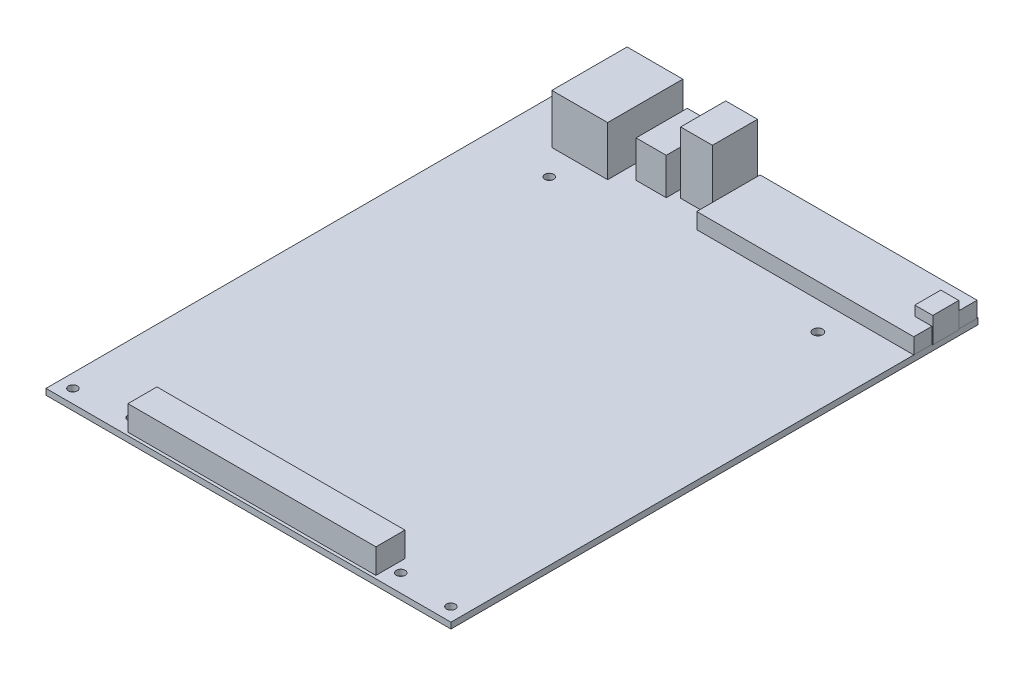
from build123d import *

# Parameters (mm, degrees)
SKETCH1_W           = 114.55401
SKETCH1_H           = 149.09799
SKETCH1_R           = 1.249995
SKETCH1_R_2         = 1.37919162
BOSS_EXTRUDE1_DEPTH = 1.69
SKETCH2_W           = 15.779027005
SKETCH2_H           = 21.279879663
BOSS_EXTRUDE2_DEPTH = 14
SKETCH2_3_W         = 70.152219837
SKETCH2_3_H         = 8.208296776
BOSS_EXTRUDE3_DEPTH = 7
SKETCH2_4_W         = 8.526889658
SKETCH2_4_H         = 14.502739447
BOSS_EXTRUDE4_DEPTH = 10.4
BOSS_EXTRUDE5_DEPTH = 4.46
SKETCH2_6_W         = 5.077021517
SKETCH2_6_H         = 7.355
BOSS_EXTRUDE6_DEPTH = 7.22
SKETCH3_W           = 8.992
SKETCH3_H           = 17.501
BOSS_EXTRUDE7_DEPTH = 12.76


with BuildPart() as part:
    # Sketch1 → Boss-Extrude1 (new body)
    with BuildSketch(Plane(origin=(0, 0, 0), x_dir=(1, 0, 0), z_dir=(0, 1, 0))):
        with Locations((57.376465546, 74.495783937)):
            Rectangle(SKETCH1_W, SKETCH1_H)
        with Locations((3.909460546, 145.234788937)):
            Circle(SKETCH1_R, mode=Mode.SUBTRACT)
        with Locations((19.453930546, 122.946818937)):
            Circle(SKETCH1_R, mode=Mode.SUBTRACT)
        with Locations((95.452630546, 122.946818937)):
            Circle(SKETCH1_R_2, mode=Mode.SUBTRACT)
        with Locations((3.909460546, 3.756788937)):
            Circle(SKETCH1_R, mode=Mode.SUBTRACT)
        with Locations((19.453930546, 4.946808937)):
            Circle(SKETCH1_R, mode=Mode.SUBTRACT)
        with Locations((95.452630546, 4.946808937)):
            Circle(SKETCH1_R, mode=Mode.SUBTRACT)
        with Locations((110.843460546, 3.756788937)):
            Circle(SKETCH1_R, mode=Mode.SUBTRACT)
    extrude(amount=BOSS_EXTRUDE1_DEPTH)

    # Sketch2 → Boss-Extrude2 (add)
    with BuildSketch(Plane(origin=(0, 1.69, 0), x_dir=(1, 0, 0), z_dir=(0, 1, 0))):
        with Locations((20.527770766, 141.147336322)):
            Rectangle(SKETCH2_W, SKETCH2_H)
    extrude(amount=BOSS_EXTRUDE2_DEPTH)

    # Sketch2<3> → Boss-Extrude3 (add)
    with BuildSketch(Plane(origin=(0, 1.69, 0), x_dir=(1, 0, 0), z_dir=(0, 1, 0))):
        with Locations((57.504496967, 4.897528339)):
            Rectangle(SKETCH2_3_W, SKETCH2_3_H)
    extrude(amount=BOSS_EXTRUDE3_DEPTH)

    # Sketch2<4> → Boss-Extrude4 (add)
    with BuildSketch(Plane(origin=(0, 1.69, 0), x_dir=(1, 0, 0), z_dir=(0, 1, 0))):
        with Locations((36.859301714, 141.628157004)):
            Rectangle(SKETCH2_4_W, SKETCH2_4_H)
    extrude(amount=BOSS_EXTRUDE4_DEPTH)

    # Sketch3 → Boss-Extrude7 (add)
    with BuildSketch(Plane(origin=(0, 0, -149.044778937), x_dir=(-1, 0, 0), z_dir=(0, 0, -1))):
        with Locations((-47.788258207, 10.416744921)):
            Rectangle(SKETCH3_W, SKETCH3_H)
    extrude(amount=-BOSS_EXTRUDE7_DEPTH)


with BuildPart() as body_2:
    # Sketch2<5> → Boss-Extrude5 (new body)
    with BuildSketch(Plane(origin=(0, 1.69, 0), x_dir=(1, 0, 0), z_dir=(0, 1, 0))):
        Polygon((53.270056885, 130.871941106), (114.653216885, 130.871941106), (114.653216885, 136.020576727), (109.800056884, 136.020576727), (109.800056884, 143.375576727), (114.653216885, 143.375576727), (114.653216885, 148.790576727), (53.270056885, 148.790576727), align=None)
    extrude(amount=BOSS_EXTRUDE5_DEPTH)


with BuildPart() as body_3:
    # Sketch2<6> → Boss-Extrude6 (new body)
    with BuildSketch(Plane(origin=(0, 1.69, 0), x_dir=(1, 0, 0), z_dir=(0, 1, 0))):
        with Locations((112.338567643, 139.698076727)):
            Rectangle(SKETCH2_6_W, SKETCH2_6_H)
    extrude(amount=BOSS_EXTRUDE6_DEPTH)


solid = Compound([part.part, body_2.part, body_3.part])
